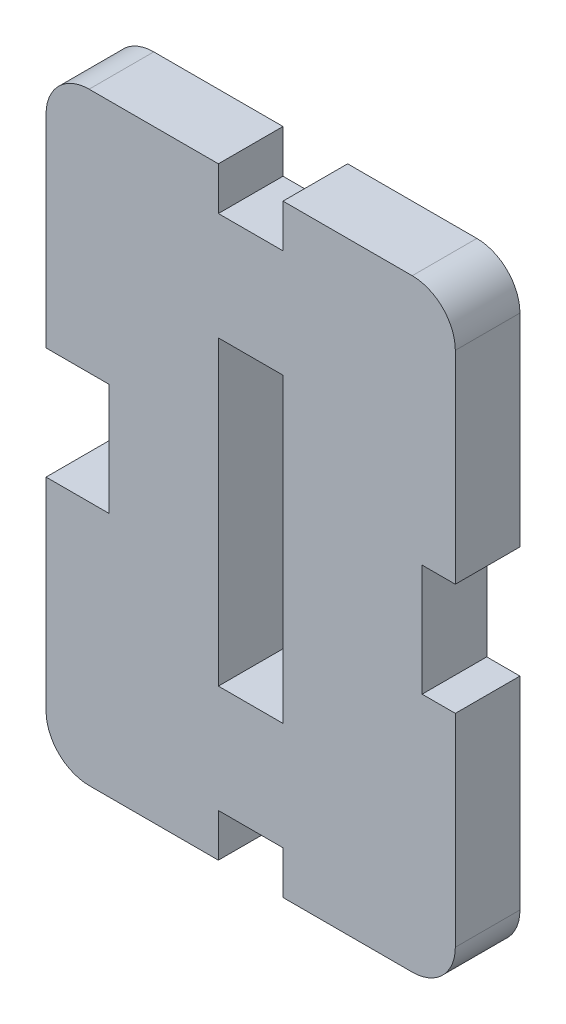
from build123d import *

# Parameters (mm, degrees)
SKETCH1_W          = 3
SKETCH1_H          = 14
BASE_EXTRUDE_DEPTH = 3


with BuildPart() as part:
    # Sketch1 → Base-Extrude (new body)
    with BuildSketch(Plane.XY):
        with BuildLine():
            Line((-1033.116910611, 53.997744838), (-1033.116910611, 44.593073912))
            Line((-1033.116910611, 44.593073912), (-1034.65769353, 44.593073912))
            Line((-1034.65769353, 44.593073912), (-1034.65769353, 39.402415763))
            Line((-1034.65769353, 39.402415763), (-1033.116910611, 39.402415763))
            Line((-1033.116910611, 39.402415763), (-1033.116910611, 29.997744838))
            ThreePointArc((-1033.116910611, 29.997744838), (-1033.702697049, 28.583531275), (-1035.116910611, 27.997744838))
            Line((-1035.116910611, 27.997744838), (-1041.116910611, 27.997744838))
            Line((-1041.116910611, 27.997744838), (-1041.116910611, 29.997744838))
            Line((-1041.116910611, 29.997744838), (-1042.616910611, 29.997744838))
            Line((-1042.616910611, 29.997744838), (-1044.116910611, 29.997744838))
            Line((-1044.116910611, 29.997744838), (-1044.116910611, 27.997744838))
            Line((-1044.116910611, 27.997744838), (-1050.116910611, 27.997744838))
            ThreePointArc((-1050.116910611, 27.997744838), (-1051.531124173, 28.583531275), (-1052.116910611, 29.997744838))
            Line((-1052.116910611, 29.997744838), (-1052.116910611, 39.402415763))
            Line((-1052.116910611, 39.402415763), (-1049.190418334, 39.402415763))
            Line((-1049.190418334, 39.402415763), (-1049.190418334, 44.593073912))
            Line((-1049.190418334, 44.593073912), (-1052.116910611, 44.593073912))
            Line((-1052.116910611, 44.593073912), (-1052.116910611, 53.997744838))
            ThreePointArc((-1052.116910611, 53.997744838), (-1051.531124173, 55.4119584), (-1050.116910611, 55.997744838))
            Line((-1050.116910611, 55.997744838), (-1044.116910611, 55.997744838))
            Line((-1044.116910611, 55.997744838), (-1044.116910611, 53.997744838))
            Line((-1044.116910611, 53.997744838), (-1042.616910611, 53.997744838))
            Line((-1042.616910611, 53.997744838), (-1041.116910611, 53.997744838))
            Line((-1041.116910611, 53.997744838), (-1041.116910611, 55.997744838))
            Line((-1041.116910611, 55.997744838), (-1035.116910611, 55.997744838))
            ThreePointArc((-1035.116910611, 55.997744838), (-1033.702697049, 55.4119584), (-1033.116910611, 53.997744838))
        make_face()
        with Locations((-1042.616910611, 41.997744838)):
            Rectangle(SKETCH1_W, SKETCH1_H, mode=Mode.SUBTRACT)
    extrude(amount=BASE_EXTRUDE_DEPTH)


solid = part.part
